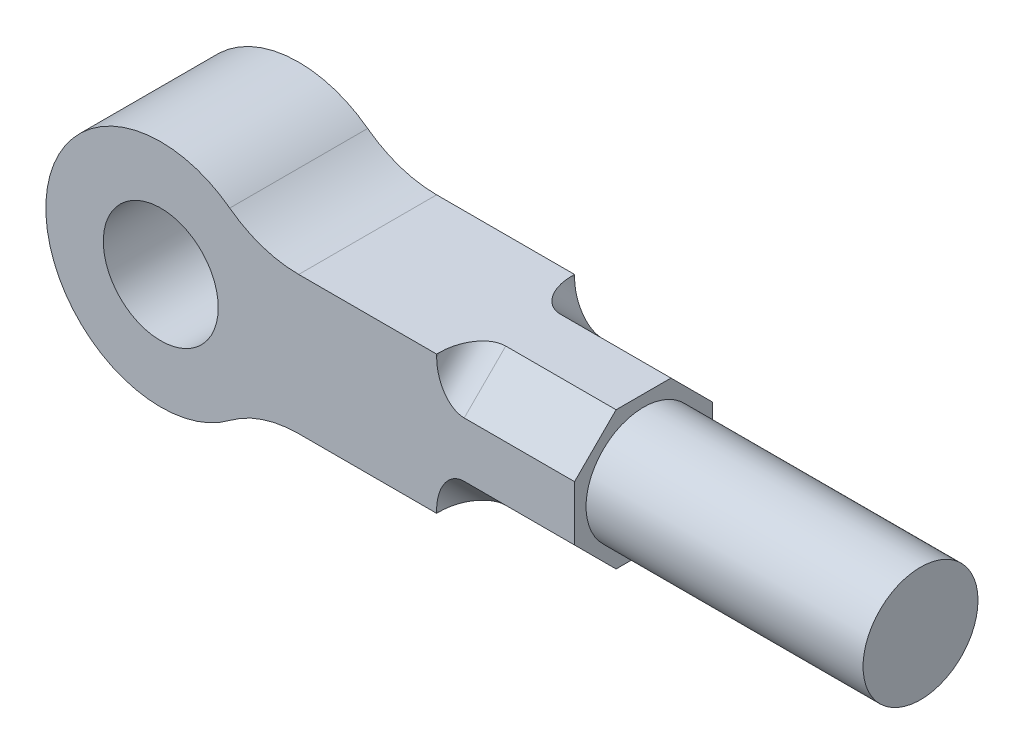
from build123d import *

# Parameters (mm, degrees)
SKETCH1_R           = 25
BOSS_EXTRUDE1_DEPTH = 60
FILLET1_R           = 50
CUT_EXTRUDE1_DEPTH  = 60
SKETCH2_4_R         = 25
BOSS_EXTRUDE2_DEPTH = 120.5
FILLET2_R           = 12


with BuildPart() as part:
    # Sketch1 → Boss-Extrude1 (new body)
    with BuildSketch(Plane.XY):
        with BuildLine():
            Line((40, 30), (180, 30))
            Line((180, 30), (180, -30))
            Line((180, -30), (40, -30))
            ThreePointArc((40, -30), (-50, 0), (40, 30))
        make_face()
        Circle(SKETCH1_R, mode=Mode.SUBTRACT)
    extrude(amount=BOSS_EXTRUDE1_DEPTH)

    # Fillet1
    fillet1_edges = [part.edges().sort_by_distance(p)[0] for p in [
        (40, -30, 30),
        (40, 30, 30),
    ]]
    fillet(fillet1_edges, radius=FILLET1_R)

    # Sketch2 → Cut-Extrude1 (cut)
    with BuildSketch(Plane(origin=(180, 0, 0), x_dir=(0, 0, -1), z_dir=(1, 0, 0))):
        Polygon((0, 11.94), (-18.06, 30), (0, 30), align=None)
        Polygon((-18.06, -30), (0, -11.94), (0, -30), align=None)
        Polygon((-60, -11.94), (-41.94, -30), (-60, -30), align=None)
        Polygon((-41.94, 30), (-60, 11.94), (-60, 30), align=None)
    extrude(amount=-CUT_EXTRUDE1_DEPTH, mode=Mode.SUBTRACT)

    # Sketch2<4> → Boss-Extrude2 (add)
    with BuildSketch(Plane(origin=(180, 0, 0), x_dir=(0, 0, -1), z_dir=(1, 0, 0))):
        with Locations((-30, 0)):
            Circle(SKETCH2_4_R)
    extrude(amount=BOSS_EXTRUDE2_DEPTH)

    # Fillet2
    fillet2_edges = [part.edges().sort_by_distance(p)[0] for p in [
        (120, -20.97, 50.97),
        (120, -20.97, 9.03),
        (120, 20.97, 9.03),
        (120, 20.97, 50.97),
    ]]
    fillet(fillet2_edges, radius=FILLET2_R)


solid = part.part
